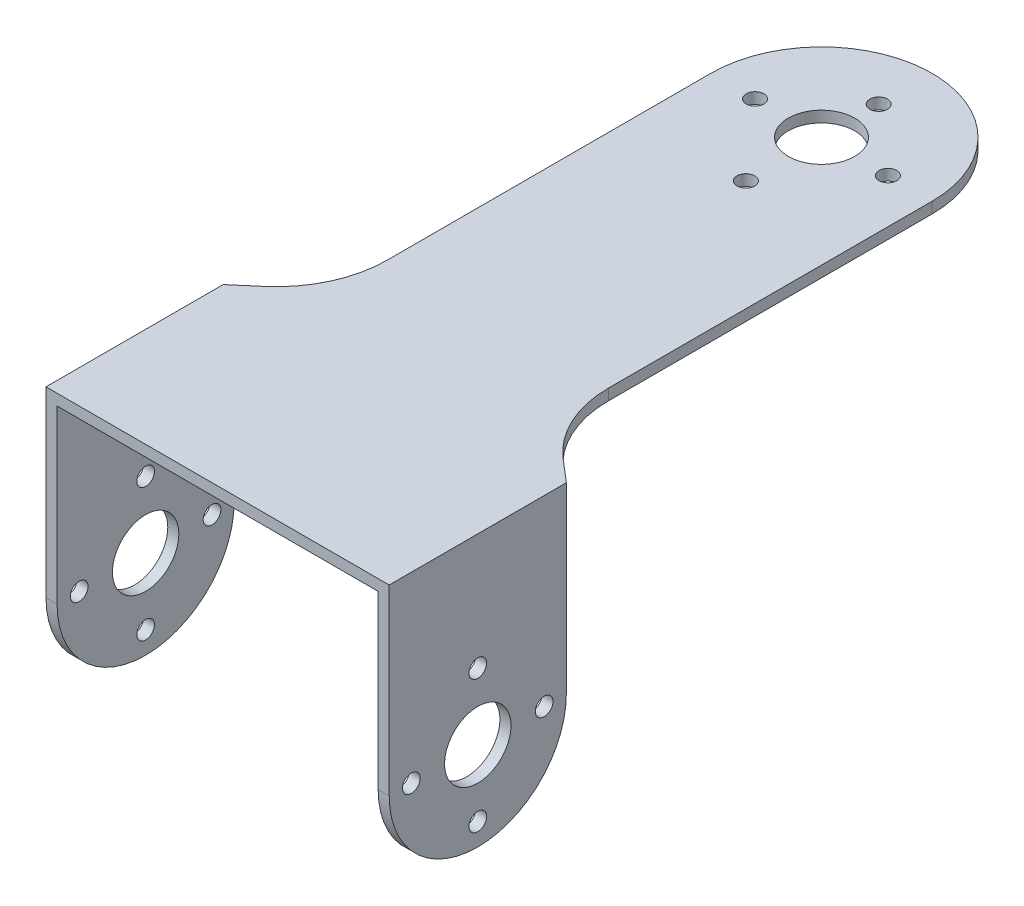
from build123d import *

# Parameters (mm, degrees)
SKETCH1_R           = 0.8
SKETCH1_R_2         = 3
BOSS_EXTRUDE1_DEPTH = 31
BOSS_EXTRUDE2_DEPTH = 1
SKETCH5_R           = 0.8
CUT_EXTRUDE3_DEPTH  = 1
SKETCH5_3_R         = 3
CUT_EXTRUDE4_DEPTH  = 1
CUT_EXTRUDE5_START  = -1
CUT_EXTRUDE5_DEPTH  = 100.186902849


with BuildPart() as part:
    # Sketch1 → Boss-Extrude1 (new body)
    with BuildSketch(Plane(origin=(0, 0, 0), x_dir=(0, 0, -1), z_dir=(1, 0, 0))):
        with BuildLine():
            Line((27.520646447, 38.775594), (27.520646447, 55.275594))
            Line((27.520646447, 55.275594), (43.520646447, 55.275594))
            Line((43.520646447, 55.275594), (43.520646447, 38.775594))
            ThreePointArc((43.520646447, 38.775594), (35.520646447, 30.775594), (27.520646447, 38.775594))
        make_face()
        with Locations((35.520646447, 44.775594)):
            Circle(SKETCH1_R, mode=Mode.SUBTRACT)
        with Locations((41.515881392, 38.775594)):
            Circle(SKETCH1_R, mode=Mode.SUBTRACT)
        with Locations((35.520646447, 32.775594)):
            Circle(SKETCH1_R, mode=Mode.SUBTRACT)
        with Locations((29.515881392, 38.775594)):
            Circle(SKETCH1_R, mode=Mode.SUBTRACT)
        with Locations((35.520646447, 38.775594)):
            Circle(SKETCH1_R_2, mode=Mode.SUBTRACT)
    extrude(amount=BOSS_EXTRUDE1_DEPTH)

    # Sketch4 → Boss-Extrude2 (add)
    with BuildSketch(Plane(origin=(0, 55.275594, 0), x_dir=(1, 0, 0), z_dir=(0, 1, 0))):
        with BuildLine():
            Line((0, 43.520646447), (31, 43.520646447))
            Line((31, 43.520646447), (28.991162523, 45.242931174))
            ThreePointArc((28.991162523, 45.242931174), (26.414616828, 48.656689929), (25.5, 52.83470532))
            Line((25.5, 52.83470532), (25.5, 82.06609312))
            ThreePointArc((25.5, 82.06609312), (15.5, 92.06609312), (5.5, 82.06609312))
            Line((5.5, 82.06609312), (5.5, 52.83470532))
            ThreePointArc((5.5, 52.83470532), (4.585383172, 48.656689929), (2.008837477, 45.242931174))
            Line((2.008837477, 45.242931174), (0, 43.520646447))
        make_face()
    extrude(amount=-BOSS_EXTRUDE2_DEPTH)

    # Sketch5 → Cut-Extrude3 (cut)
    with BuildSketch(Plane.XZ.offset(-54.275594)):
        with Locations((9.5, -82.06609312)):
            Circle(SKETCH5_R)
        with Locations((15.5, -75.236093118)):
            Circle(SKETCH5_R)
        with Locations((21.5, -82.06609312)):
            Circle(SKETCH5_R)
        with Locations((15.5, -87.236093118)):
            Circle(SKETCH5_R)
    extrude(amount=-CUT_EXTRUDE3_DEPTH, mode=Mode.SUBTRACT)

    # Sketch5<3> → Cut-Extrude4 (cut)
    with BuildSketch(Plane.XZ.offset(-54.275594)):
        with Locations((15.5, -82.06609312)):
            Circle(SKETCH5_3_R)
    extrude(amount=-CUT_EXTRUDE4_DEPTH, mode=Mode.SUBTRACT)

    # Sketch6 → Cut-Extrude5 (cut, through all)
    with BuildSketch(Plane(origin=(0, 55.275594, 0), x_dir=(1, 0, 0), z_dir=(0, 1, 0)).offset(CUT_EXTRUDE5_START)):
        Polygon((0.999214172, 44.172026991), (0.999214172, 43.494699328), (0.999214172, 27.546593566), (0.999214172, 27.028954782), (30.000785828, 27.028954782), (30.000785828, 27.546593566), (30.000785828, 43.494699328), (30.000785828, 44.172026991), align=None)
    extrude(amount=-CUT_EXTRUDE5_DEPTH, mode=Mode.SUBTRACT)


solid = part.part
